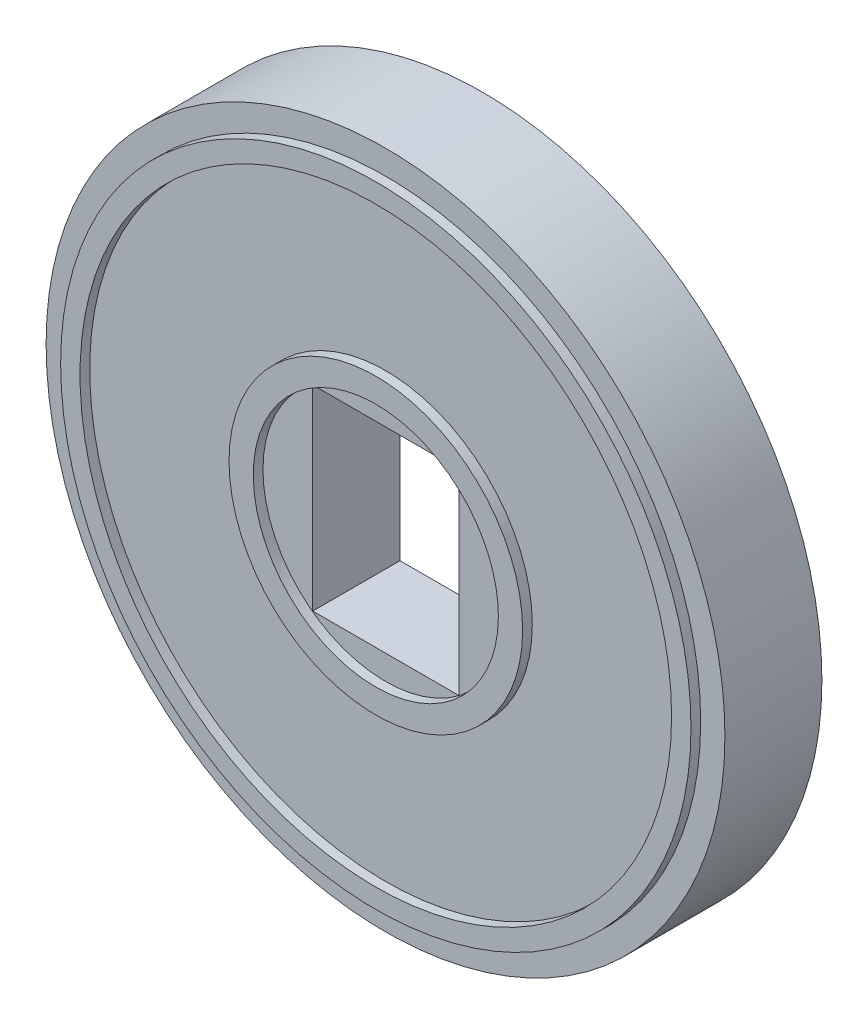
from build123d import *
from OCP.BRepFilletAPI import BRepFilletAPI_MakeChamfer

# Parameters (mm, degrees)
SKIZZE1_R                            = 35
AUFSATZ_LINEAR_AUSTRAGEN1_DEPTH      = 10
SKIZZE1_3_OUTSIDE_W                  = 91.9
SKIZZE1_3_OUTSIDE_H                  = 91.9
SKIZZE1_3_OUTSIDE_R                  = 35
SKIZZE1_3_OUTSIDE_W_2                = 15.1
SKIZZE1_3_OUTSIDE_H_2                = 20.2
SCHNITT_LINEAR_AUSTRAGEN1_DEPTH      = 10
SCHNITT_LINEAR_AUSTRAGEN2_DEPTH      = 1
SCHNITT_LINEAR_AUSTRAGEN2_DEPTH_BACK = 8
SKIZZE2_R                            = 5.1
SKIZZE3_R                            = 32.5
SKIZZE3_R_2                          = 30.5
AUFSATZ_LINEAR_AUSTRAGEN2_DEPTH      = 1
SKIZZE4_R                            = 15.137010129
SKIZZE4_R_2                          = 12.637010129
AUFSATZ_LINEAR_AUSTRAGEN3_DEPTH      = 1
FASE1_SIZE                           = 1
FASE1_SIZE2                          = 5.67128182


with BuildPart() as part:
    # Skizze1 → Aufsatz-Linear austragen1 (new body)
    with BuildSketch(Plane.XY):
        Circle(SKIZZE1_R)
    extrude(amount=AUFSATZ_LINEAR_AUSTRAGEN1_DEPTH)

    # Skizze1<3> outside → Schnitt-Linear austragen1 (cut)
    # profile 1 of 2: a face of its own
    with BuildSketch(Plane.XY):
        Rectangle(SKIZZE1_3_OUTSIDE_W, SKIZZE1_3_OUTSIDE_H)
        Circle(SKIZZE1_3_OUTSIDE_R, mode=Mode.SUBTRACT)
    # profile 2 of 2: a face of its own
    with BuildSketch(Plane.XY):
        with Locations((0.045, 0)):
            Rectangle(SKIZZE1_3_OUTSIDE_W_2, SKIZZE1_3_OUTSIDE_H_2)
    extrude(amount=SCHNITT_LINEAR_AUSTRAGEN1_DEPTH, mode=Mode.SUBTRACT)

    # Skizze2 → Schnitt-Linear austragen2 (cut, two sides: drawn at the far end of the back side and taken through both)
    with BuildSketch(Plane(origin=(0, 0, 0), x_dir=(-1, 0, 0), z_dir=(0, 0, -1)).offset(-SCHNITT_LINEAR_AUSTRAGEN2_DEPTH_BACK)):
        with Locations((0, 25)):
            Circle(SKIZZE2_R)
    extrude(amount=SCHNITT_LINEAR_AUSTRAGEN2_DEPTH + SCHNITT_LINEAR_AUSTRAGEN2_DEPTH_BACK, mode=Mode.SUBTRACT)

    # Skizze3 → Aufsatz-Linear austragen2 (add)
    with BuildSketch(Plane.XY.offset(10)):
        Circle(SKIZZE3_R)
        Circle(SKIZZE3_R_2, mode=Mode.SUBTRACT)
    extrude(amount=AUFSATZ_LINEAR_AUSTRAGEN2_DEPTH)

    # Skizze4 → Aufsatz-Linear austragen3 (add)
    with BuildSketch(Plane.XY.offset(10)):
        Circle(SKIZZE4_R)
        Circle(SKIZZE4_R_2, mode=Mode.SUBTRACT)
    extrude(amount=AUFSATZ_LINEAR_AUSTRAGEN3_DEPTH)

    # Fase1: one chamfer whose edges measure the first distance from different faces: ONE call of the kernel's chamfer builder (chamfer() names one face for all edges)
    fase1_edges_1 = [part.edges().sort_by_distance(p)[0] for p in [
        (-7.505, 0, 0),
    ]]
    fase1_side_1 = [part.faces().sort_by_distance(p)[0] for p in [
        (-7.505, 0, 5),
    ]]
    fase1_edges_2 = [part.edges().sort_by_distance(p)[0] for p in [
        (0.045, 10.1, 0),
    ]]
    fase1_side_2 = [part.faces().sort_by_distance(p)[0] for p in [
        (0.045, 10.1, 5),
    ]]
    fase1_edges_3 = [part.edges().sort_by_distance(p)[0] for p in [
        (7.595, 0, 0),
    ]]
    fase1_side_3 = [part.faces().sort_by_distance(p)[0] for p in [
        (7.595, 0, 5),
    ]]
    fase1_edges_4 = [part.edges().sort_by_distance(p)[0] for p in [
        (0.045, -10.1, 0),
    ]]
    fase1_side_4 = [part.faces().sort_by_distance(p)[0] for p in [
        (0.045, -10.1, 5),
    ]]
    fase1 = BRepFilletAPI_MakeChamfer(part.part.solid().wrapped)
    for e in fase1_edges_1:
        fase1.Add(FASE1_SIZE, FASE1_SIZE2, e.wrapped, fase1_side_1[0].wrapped)  # the first distance lies on this face
    for e in fase1_edges_2:
        fase1.Add(FASE1_SIZE, FASE1_SIZE2, e.wrapped, fase1_side_2[0].wrapped)  # the first distance lies on this face
    for e in fase1_edges_3:
        fase1.Add(FASE1_SIZE, FASE1_SIZE2, e.wrapped, fase1_side_3[0].wrapped)  # the first distance lies on this face
    for e in fase1_edges_4:
        fase1.Add(FASE1_SIZE, FASE1_SIZE2, e.wrapped, fase1_side_4[0].wrapped)  # the first distance lies on this face
    add(Compound.cast(fase1.Shape()), mode=Mode.REPLACE)


solid = part.part
